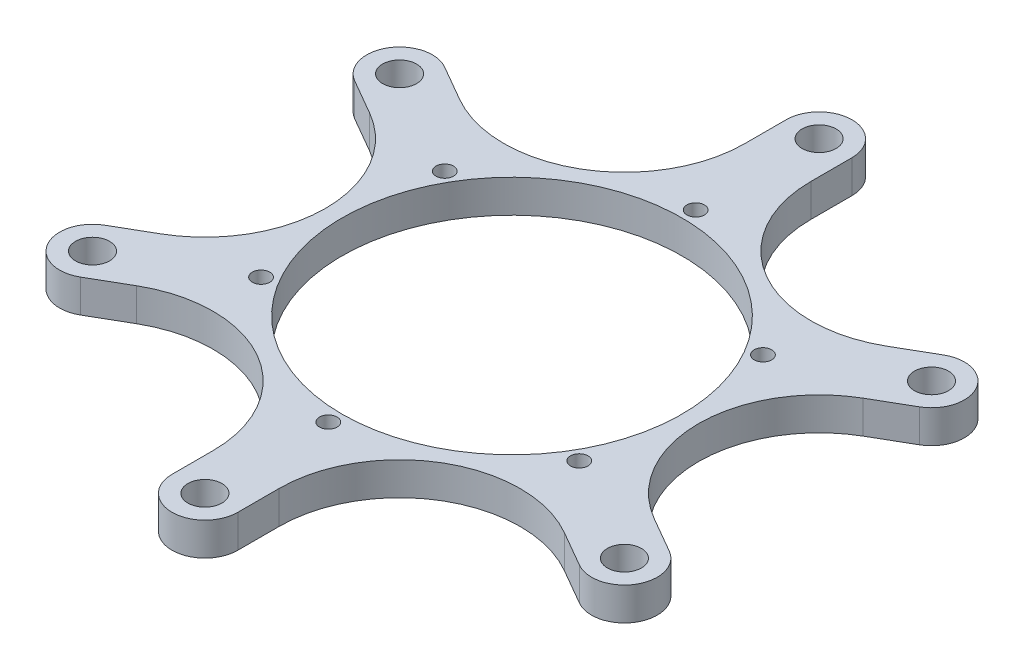
from build123d import *

# Parameters (mm, degrees)
SKETCH_1_R               = 31
EXTRUDE_1_DEPTH          = 6
SKETCH_2_R               = 1.6
SKETCH_2_R_2             = 3.1
CUT_EXTRUDE_1_DEPTH      = 6
PATTERN_CIRCULAR_1_COUNT = 6


with BuildPart() as part:
    # 草图1 → 凸台-拉伸1 (new body)
    with BuildSketch(Plane(origin=(0, 0, 0), x_dir=(1, 0, 0), z_dir=(0, 1, 0))):
        with BuildLine():
            Line((6, 56), (6, 48.497422612))
            ThreePointArc((6, 48.497422612), (17, 29.444863729), (39, 29.444863729))
            Line((39, 29.444863729), (45.497422612, 33.196152423))
            ThreePointArc((45.497422612, 33.196152423), (50.050336883, 33.795554958), (53.693575035, 31))
            ThreePointArc((53.693575035, 31), (54.29297757, 26.447085729), (51.497422612, 22.803847577))
            Line((51.497422612, 22.803847577), (45, 19.052558883))
            ThreePointArc((45, 19.052558883), (34, 0), (45, -19.052558883))
            Line((45, -19.052558883), (51.497422612, -22.803847577))
            ThreePointArc((51.497422612, -22.803847577), (54.29297757, -26.447085729), (53.693575035, -31))
            ThreePointArc((53.693575035, -31), (50.050336883, -33.795554958), (45.497422612, -33.196152423))
            Line((45.497422612, -33.196152423), (39, -29.444863729))
            ThreePointArc((39, -29.444863729), (17, -29.444863729), (6, -48.497422612))
            Line((6, -48.497422612), (6, -56))
            ThreePointArc((6, -56), (4.242640687, -60.242640687), (0, -62))
            ThreePointArc((0, -62), (-4.242640687, -60.242640687), (-6, -56))
            Line((-6, -56), (-6, -48.497422612))
            ThreePointArc((-6, -48.497422612), (-17, -29.444863729), (-39, -29.444863729))
            Line((-39, -29.444863729), (-45.497422612, -33.196152423))
            ThreePointArc((-45.497422612, -33.196152423), (-50.050336883, -33.795554958), (-53.693575035, -31))
            ThreePointArc((-53.693575035, -31), (-54.29297757, -26.447085729), (-51.497422612, -22.803847577))
            Line((-51.497422612, -22.803847577), (-45, -19.052558883))
            ThreePointArc((-45, -19.052558883), (-34, 0), (-45, 19.052558883))
            Line((-45, 19.052558883), (-51.497422612, 22.803847577))
            ThreePointArc((-51.497422612, 22.803847577), (-54.29297757, 26.447085729), (-53.693575035, 31))
            ThreePointArc((-53.693575035, 31), (-50.050336883, 33.795554958), (-45.497422612, 33.196152423))
            Line((-45.497422612, 33.196152423), (-39, 29.444863729))
            ThreePointArc((-39, 29.444863729), (-17, 29.444863729), (-6, 48.497422612))
            Line((-6, 48.497422612), (-6, 56))
            ThreePointArc((-6, 56), (-4.242640687, 60.242640687), (0, 62))
            ThreePointArc((0, 62), (4.242640687, 60.242640687), (6, 56))
        make_face()
        with Locations(Location((0, 0, 0), (0, 0, 270))):
            Circle(SKETCH_1_R, mode=Mode.SUBTRACT)
    extrude(amount=EXTRUDE_1_DEPTH)

    # 草图2 → 切除-拉伸1 (cut)
    with BuildSketch(Plane(origin=(0, 6, 0), x_dir=(1, 0, 0), z_dir=(0, 1, 0))):
        with Locations(Location((0, 33.5, 0), (0, 0, 270))):
            Circle(SKETCH_2_R)
        with Locations(Location((0, 56, 0), (0, 0, 270))):
            Circle(SKETCH_2_R_2)
    cut_extrude_1 = extrude(amount=-CUT_EXTRUDE_1_DEPTH, mode=Mode.SUBTRACT)

    # 阵列(圆周)1: 切除-拉伸1 ×6 about axis
    pattern_circular_1_axis = Axis((0, 0, 0), (0, 1, 0))
    for i in range(1, PATTERN_CIRCULAR_1_COUNT):
        add(cut_extrude_1.rotate(pattern_circular_1_axis, i * 360 / PATTERN_CIRCULAR_1_COUNT), mode=Mode.SUBTRACT)


solid = part.part
